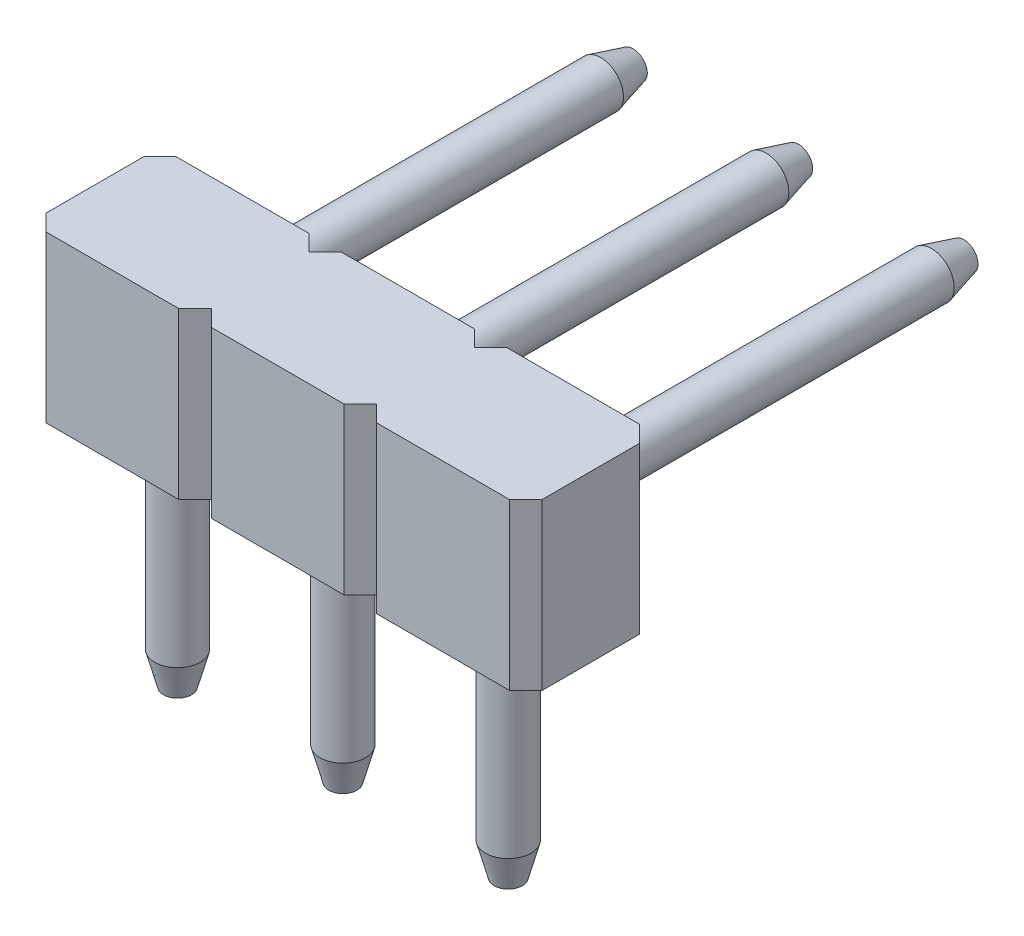
from build123d import *
from OCP.BRepFilletAPI import BRepFilletAPI_MakeChamfer

# Parameters (mm, degrees)
BOSS_EXTRU_1_DEPTH        = 1
BOSS_EXTRU_1_DEPTH_BACK   = 3.5
ESQUISSE1_R               = 0.35
BOSS_EXTRU_1_2_DEPTH      = 1
BOSS_EXTRU_1_2_DEPTH_BACK = 3.5
BOSS_EXTRU_1_3_DEPTH      = 1
BOSS_EXTRU_1_3_DEPTH_BACK = 3.5
CHANFREIN1_SIZE           = 0.5
CHANFREIN1_SIZE2          = 0.133974596
CHANFREIN2_SIZE           = 0.5
CHANFREIN2_SIZE2          = 0.133974596
CHANFREIN3_SIZE           = 0.5
CHANFREIN3_SIZE2          = 0.133974596
BOSS_EXTRU_2_DEPTH        = 2.54
ESQUISSE3_R               = 0.35
BOSS_EXTRU_3_DEPTH        = 6
CHANFREIN4_SIZE           = 0.5
CHANFREIN4_SIZE2          = 0.133974596


with BuildPart() as part:
    # Esquisse1 → Boss.-Extru.1 (new, two sides: drawn at the far end of the back side and taken through both)
    with BuildSketch(Plane(origin=(0, 0, 0), x_dir=(1, 0, 0), z_dir=(0, 1, 0)).offset(-BOSS_EXTRU_1_DEPTH_BACK)):
        with Locations(Location((0, 0, 0), (0, 0, 270))):
            Circle(ESQUISSE1_R)
    extrude(amount=BOSS_EXTRU_1_DEPTH + BOSS_EXTRU_1_DEPTH_BACK)

    # Chanfrein1: one chamfer whose edges measure the first distance from different faces: ONE call of the kernel's chamfer builder (chamfer() names one face for all edges)
    chanfrein1_edges_1 = [part.edges().sort_by_distance(p)[0] for p in [
        (0, -3.5, -0.35),
    ]]
    chanfrein1_side_1 = [part.faces().sort_by_distance(p)[0] for p in [
        (0, -1.75, -0.35),
    ]]
    chanfrein1_edges_2 = [part.edges().sort_by_distance(p)[0] for p in [
        (0, 1, -0.35),
    ]]
    chanfrein1_side_2 = [part.faces().sort_by_distance(p)[0] for p in [
        (0, 0.5, -0.35),
    ]]
    chanfrein1 = BRepFilletAPI_MakeChamfer(part.part.solid().wrapped)
    for e in chanfrein1_edges_1:
        chanfrein1.Add(CHANFREIN1_SIZE, CHANFREIN1_SIZE2, e.wrapped, chanfrein1_side_1[0].wrapped)  # the first distance lies on this face
    for e in chanfrein1_edges_2:
        chanfrein1.Add(CHANFREIN1_SIZE, CHANFREIN1_SIZE2, e.wrapped, chanfrein1_side_2[0].wrapped)  # the first distance lies on this face
    add(Compound.cast(chanfrein1.Shape()), mode=Mode.REPLACE)

    # Esquisse2 → Boss.-Extru.2 (add)
    with BuildSketch(Plane(origin=(0, 0, 0), x_dir=(1, 0, 0), z_dir=(0, 1, 0))):
        Polygon((-1.27, 0.75), (-1.02, 1), (1.02, 1), (1.27, 0.75), (1.52, 1), (3.56, 1), (3.81, 0.75), (4.06, 1), (6.1, 1), (6.35, 0.75), (6.35, -0.750018973), (6.096707403, -1.000018973), (4.06, -1.000018973), (3.81, -0.750018973), (3.556707403, -1.000018973), (1.52, -1.000018973), (1.27, -0.750018973), (1.016707403, -1.000018973), (-1.02, -1.000018973), (-1.27, -0.750018973), align=None)
    extrude(amount=BOSS_EXTRU_2_DEPTH)

    # Esquisse3 → Boss.-Extru.3 (add)
    with BuildSketch(Plane(origin=(0, 0, -1), x_dir=(-1, 0, 0), z_dir=(0, 0, -1))):
        with Locations(Location((-5.08, 1.27, 0), (0, 0, 180))):
            Circle(ESQUISSE3_R)
        with Locations(Location((-2.54, 1.27, 0), (0, 0, 180))):
            Circle(ESQUISSE3_R)
        with Locations(Location((0, 1.27, 0), (0, 0, 180))):
            Circle(ESQUISSE3_R)
    extrude(amount=BOSS_EXTRU_3_DEPTH)

    # Chanfrein4: one chamfer whose edges measure the first distance from different faces: ONE call of the kernel's chamfer builder (chamfer() names one face for all edges)
    chanfrein4_edges_1 = [part.edges().sort_by_distance(p)[0] for p in [
        (4.73, 1.27, -7),
    ]]
    chanfrein4_side_1 = [part.faces().sort_by_distance(p)[0] for p in [
        (4.73, 1.27, -4),
    ]]
    chanfrein4_edges_2 = [part.edges().sort_by_distance(p)[0] for p in [
        (2.19, 1.27, -7),
    ]]
    chanfrein4_side_2 = [part.faces().sort_by_distance(p)[0] for p in [
        (2.19, 1.27, -4),
    ]]
    chanfrein4_edges_3 = [part.edges().sort_by_distance(p)[0] for p in [
        (-0.35, 1.27, -7),
    ]]
    chanfrein4_side_3 = [part.faces().sort_by_distance(p)[0] for p in [
        (-0.35, 1.27, -4),
    ]]
    chanfrein4 = BRepFilletAPI_MakeChamfer(part.part.solid().wrapped)
    for e in chanfrein4_edges_1:
        chanfrein4.Add(CHANFREIN4_SIZE, CHANFREIN4_SIZE2, e.wrapped, chanfrein4_side_1[0].wrapped)  # the first distance lies on this face
    for e in chanfrein4_edges_2:
        chanfrein4.Add(CHANFREIN4_SIZE, CHANFREIN4_SIZE2, e.wrapped, chanfrein4_side_2[0].wrapped)  # the first distance lies on this face
    for e in chanfrein4_edges_3:
        chanfrein4.Add(CHANFREIN4_SIZE, CHANFREIN4_SIZE2, e.wrapped, chanfrein4_side_3[0].wrapped)  # the first distance lies on this face
    add(Compound.cast(chanfrein4.Shape()), mode=Mode.REPLACE)


with BuildPart() as body_2:
    # Esquisse1 → Boss.-Extru.1 2 (new, two sides: drawn at the far end of the back side and taken through both)
    with BuildSketch(Plane(origin=(0, 0, 0), x_dir=(1, 0, 0), z_dir=(0, 1, 0)).offset(-BOSS_EXTRU_1_2_DEPTH_BACK)):
        with Locations(Location((2.54, 0, 0), (0, 0, 270))):
            Circle(ESQUISSE1_R)
    extrude(amount=BOSS_EXTRU_1_2_DEPTH + BOSS_EXTRU_1_2_DEPTH_BACK)

    # Chanfrein2: one chamfer whose edges measure the first distance from different faces: ONE call of the kernel's chamfer builder (chamfer() names one face for all edges)
    chanfrein2_edges_1 = [body_2.edges().sort_by_distance(p)[0] for p in [
        (2.54, -3.5, -0.35),
    ]]
    chanfrein2_side_1 = [body_2.faces().sort_by_distance(p)[0] for p in [
        (2.54, -1.75, -0.35),
    ]]
    chanfrein2_edges_2 = [body_2.edges().sort_by_distance(p)[0] for p in [
        (2.54, 1, -0.35),
    ]]
    chanfrein2_side_2 = [body_2.faces().sort_by_distance(p)[0] for p in [
        (2.54, 0.5, -0.35),
    ]]
    chanfrein2 = BRepFilletAPI_MakeChamfer(body_2.part.solid().wrapped)
    for e in chanfrein2_edges_1:
        chanfrein2.Add(CHANFREIN2_SIZE, CHANFREIN2_SIZE2, e.wrapped, chanfrein2_side_1[0].wrapped)  # the first distance lies on this face
    for e in chanfrein2_edges_2:
        chanfrein2.Add(CHANFREIN2_SIZE, CHANFREIN2_SIZE2, e.wrapped, chanfrein2_side_2[0].wrapped)  # the first distance lies on this face
    add(Compound.cast(chanfrein2.Shape()), mode=Mode.REPLACE)


with BuildPart() as body_3:
    # Esquisse1 → Boss.-Extru.1 3 (new, two sides: drawn at the far end of the back side and taken through both)
    with BuildSketch(Plane(origin=(0, 0, 0), x_dir=(1, 0, 0), z_dir=(0, 1, 0)).offset(-BOSS_EXTRU_1_3_DEPTH_BACK)):
        with Locations(Location((5.08, 0, 0), (0, 0, 270))):
            Circle(ESQUISSE1_R)
    extrude(amount=BOSS_EXTRU_1_3_DEPTH + BOSS_EXTRU_1_3_DEPTH_BACK)

    # Chanfrein3: one chamfer whose edges measure the first distance from different faces: ONE call of the kernel's chamfer builder (chamfer() names one face for all edges)
    chanfrein3_edges_1 = [body_3.edges().sort_by_distance(p)[0] for p in [
        (5.08, -3.5, -0.35),
    ]]
    chanfrein3_side_1 = [body_3.faces().sort_by_distance(p)[0] for p in [
        (5.08, -1.75, -0.35),
    ]]
    chanfrein3_edges_2 = [body_3.edges().sort_by_distance(p)[0] for p in [
        (5.08, 1, -0.35),
    ]]
    chanfrein3_side_2 = [body_3.faces().sort_by_distance(p)[0] for p in [
        (5.08, 0.5, -0.35),
    ]]
    chanfrein3 = BRepFilletAPI_MakeChamfer(body_3.part.solid().wrapped)
    for e in chanfrein3_edges_1:
        chanfrein3.Add(CHANFREIN3_SIZE, CHANFREIN3_SIZE2, e.wrapped, chanfrein3_side_1[0].wrapped)  # the first distance lies on this face
    for e in chanfrein3_edges_2:
        chanfrein3.Add(CHANFREIN3_SIZE, CHANFREIN3_SIZE2, e.wrapped, chanfrein3_side_2[0].wrapped)  # the first distance lies on this face
    add(Compound.cast(chanfrein3.Shape()), mode=Mode.REPLACE)


solid = Compound([part.part, body_2.part, body_3.part])
